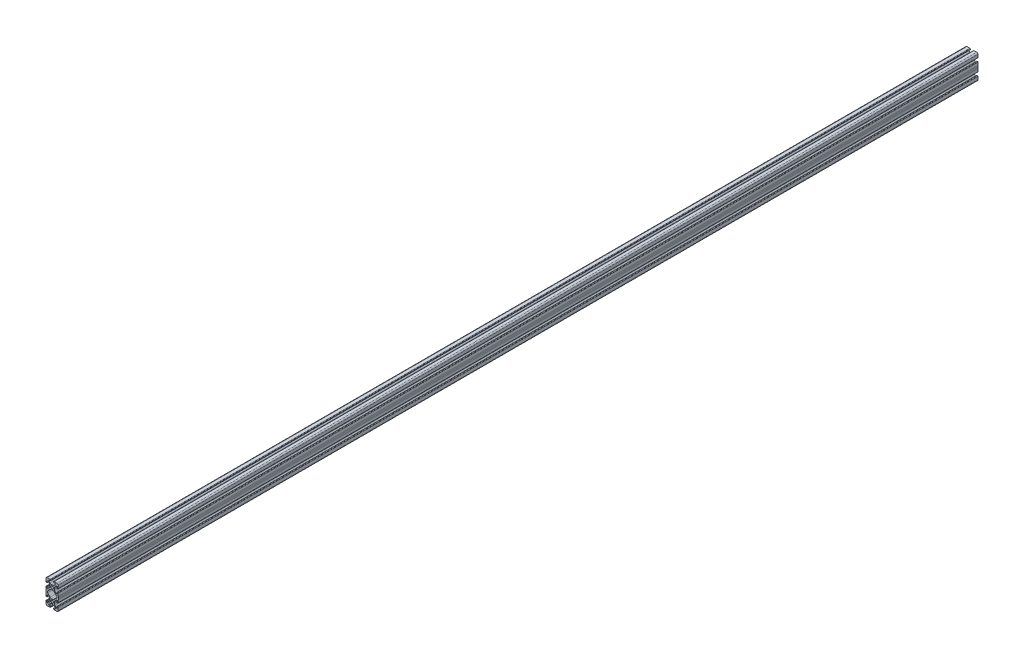
from build123d import *

# Parameters (mm, degrees)
SKETCH3_R               = 2.15
BOSS_EXTRUDE1_DEPTH     = 1524
CIRPATTERN1_COUNT       = 2
CUT_EXTRUDE1_DEPTH      = 14
CUT_EXTRUDE1_DEPTH_BACK = 23
SKETCH4_OUTSIDE_W       = 3659.666
SKETCH4_OUTSIDE_H       = 651.666
SKETCH4_OUTSIDE_W_2     = 1500
SKETCH4_OUTSIDE_H_2     = 40


with BuildPart() as part:
    # Sketch3 → Boss-Extrude1 (new, symmetric)
    with BuildSketch(Plane.XY):
        with BuildLine():
            Line((-8.30911066, 7.475083014), (-9.008684239, 7.499512662))
            ThreePointArc((-9.008684239, 7.499512662), (-9.582202525, 7.285082961), (-9.836116498, 6.727919597))
            Line((-9.836116498, 6.727919597), (-9.986803685, 2.412803152))
            ThreePointArc((-9.986803685, 2.412803152), (-9.995837451, 2.069746735), (-9.99898368, 1.726585818))
            Line((-9.99898368, 1.726585818), (-10, 0))
            Line((-10, 0), (-7.916458339, 0))
            ThreePointArc((-7.916458339, 0), (-7.764217404, 0.765366865), (-7.330671901, 1.414213562))
            Line((-7.330671901, 1.414213562), (-3.22356512, 5.521320344))
            ThreePointArc((-3.22356512, 5.521320344), (-2.250295073, 6.171638598), (-1.102244776, 6.4))
            Line((-1.102244776, 6.4), (1.102244776, 6.4))
            ThreePointArc((1.102244776, 6.4), (2.250295073, 6.171638598), (3.22356512, 5.521320344))
            Line((3.22356512, 5.521320344), (7.330671901, 1.414213562))
            ThreePointArc((7.330671901, 1.414213562), (7.764217404, 0.765366865), (7.916458339, 0))
            Line((7.916458339, 0), (10, 0))
            Line((10, 0), (9.99898368, 1.726585818))
            ThreePointArc((9.99898368, 1.726585818), (9.995837451, 2.069746735), (9.986803685, 2.412803152))
            Line((9.986803685, 2.412803152), (9.836116498, 6.727919597))
            ThreePointArc((9.836116498, 6.727919597), (9.582202525, 7.285082961), (9.008684239, 7.499512662))
            Line((9.008684239, 7.499512662), (8.30911066, 7.475083014))
            ThreePointArc((8.30911066, 7.475083014), (8.100174399, 7.379865274), (8.019763261, 7.164795917))
            Line((8.019763261, 7.164795917), (8.093719461, 5.046967452))
            ThreePointArc((8.093719461, 5.046967452), (7.631170264, 4.313871343), (6.779559917, 4.47555462))
            Line((6.779559917, 4.47555462), (4.478679656, 6.77643488))
            ThreePointArc((4.478679656, 6.77643488), (3.828361402, 7.749704927), (3.6, 8.897755224))
            Line((3.6, 8.897755224), (3.6, 11.102244776))
            ThreePointArc((3.6, 11.102244776), (3.828361402, 12.250295073), (4.478679656, 13.22356512))
            Line((4.478679656, 13.22356512), (6.779559917, 15.52444538))
            ThreePointArc((6.779559917, 15.52444538), (7.631170264, 15.686128657), (8.093719461, 14.953032548))
            Line((8.093719461, 14.953032548), (8.019763261, 12.835204083))
            ThreePointArc((8.019763261, 12.835204083), (8.100174399, 12.620134726), (8.30911066, 12.524916986))
            Line((8.30911066, 12.524916986), (9.008684239, 12.500487338))
            ThreePointArc((9.008684239, 12.500487338), (9.582202525, 12.714917039), (9.836116498, 13.272080403))
            Line((9.836116498, 13.272080403), (9.998781654, 17.930201007))
            ThreePointArc((9.998781654, 17.930201007), (9.414213562, 19.414213562), (7.930201007, 19.998781654))
            Line((7.930201007, 19.998781654), (3.272080403, 19.836116498))
            ThreePointArc((3.272080403, 19.836116498), (2.714917039, 19.582202525), (2.500487338, 19.008684239))
            Line((2.500487338, 19.008684239), (2.524916986, 18.30911066))
            ThreePointArc((2.524916986, 18.30911066), (2.620134726, 18.100174399), (2.835204083, 18.019763261))
            Line((2.835204083, 18.019763261), (4.953032548, 18.093719461))
            ThreePointArc((4.953032548, 18.093719461), (5.686128657, 17.631170264), (5.52444538, 16.779559917))
            Line((5.52444538, 16.779559917), (3.22356512, 14.478679656))
            ThreePointArc((3.22356512, 14.478679656), (2.250295073, 13.828361402), (1.102244776, 13.6))
            Line((1.102244776, 13.6), (-1.102244776, 13.6))
            ThreePointArc((-1.102244776, 13.6), (-2.250295073, 13.828361402), (-3.22356512, 14.478679656))
            Line((-3.22356512, 14.478679656), (-5.52444538, 16.779559917))
            ThreePointArc((-5.52444538, 16.779559917), (-5.686128657, 17.631170264), (-4.953032548, 18.093719461))
            Line((-4.953032548, 18.093719461), (-2.835204083, 18.019763261))
            ThreePointArc((-2.835204083, 18.019763261), (-2.620134726, 18.100174399), (-2.524916986, 18.30911066))
            Line((-2.524916986, 18.30911066), (-2.500487338, 19.008684239))
            ThreePointArc((-2.500487338, 19.008684239), (-2.714917039, 19.582202525), (-3.272080403, 19.836116498))
            Line((-3.272080403, 19.836116498), (-7.930201007, 19.998781654))
            ThreePointArc((-7.930201007, 19.998781654), (-9.414213562, 19.414213562), (-9.998781654, 17.930201007))
            Line((-9.998781654, 17.930201007), (-9.836116498, 13.272080403))
            ThreePointArc((-9.836116498, 13.272080403), (-9.582202525, 12.714917039), (-9.008684239, 12.500487338))
            Line((-9.008684239, 12.500487338), (-8.30911066, 12.524916986))
            ThreePointArc((-8.30911066, 12.524916986), (-8.100174399, 12.620134726), (-8.019763261, 12.835204083))
            Line((-8.019763261, 12.835204083), (-8.093719461, 14.953032548))
            ThreePointArc((-8.093719461, 14.953032548), (-7.631170264, 15.686128657), (-6.779559917, 15.52444538))
            Line((-6.779559917, 15.52444538), (-4.478679656, 13.22356512))
            ThreePointArc((-4.478679656, 13.22356512), (-3.828361402, 12.250295073), (-3.6, 11.102244776))
            Line((-3.6, 11.102244776), (-3.6, 8.897755224))
            ThreePointArc((-3.6, 8.897755224), (-3.828361402, 7.749704927), (-4.478679656, 6.77643488))
            Line((-4.478679656, 6.77643488), (-6.779559917, 4.47555462))
            ThreePointArc((-6.779559917, 4.47555462), (-7.631170264, 4.313871343), (-8.093719461, 5.046967452))
            Line((-8.093719461, 5.046967452), (-8.019763261, 7.164795917))
            ThreePointArc((-8.019763261, 7.164795917), (-8.100174399, 7.379865274), (-8.30911066, 7.475083014))
        make_face()
        with Locations((0, 10)):
            Circle(SKETCH3_R, mode=Mode.SUBTRACT)
    boss_extrude1 = extrude(amount=BOSS_EXTRUDE1_DEPTH, both=True)

    # CirPattern1: Boss-Extrude1 ×2 about axis
    cirpattern1_axis = Axis((0, 0, 0), (0, 0, 1))
    for i in range(1, CIRPATTERN1_COUNT):
        add(boss_extrude1.rotate(cirpattern1_axis, i * 360 / CIRPATTERN1_COUNT))

    # Sketch4 outside → Cut-Extrude1 (cut, two sides: drawn at the far end of the back side and taken through both)
    with BuildSketch(Plane(origin=(3.6, 0, 0), x_dir=(0, 0, -1), z_dir=(1, 0, 0)).offset(-CUT_EXTRUDE1_DEPTH_BACK)):
        Rectangle(SKETCH4_OUTSIDE_W, SKETCH4_OUTSIDE_H)
        with Locations((-774, 0)):
            Rectangle(SKETCH4_OUTSIDE_W_2, SKETCH4_OUTSIDE_H_2, mode=Mode.SUBTRACT)
    extrude(amount=CUT_EXTRUDE1_DEPTH + CUT_EXTRUDE1_DEPTH_BACK, mode=Mode.SUBTRACT)


solid = part.part
